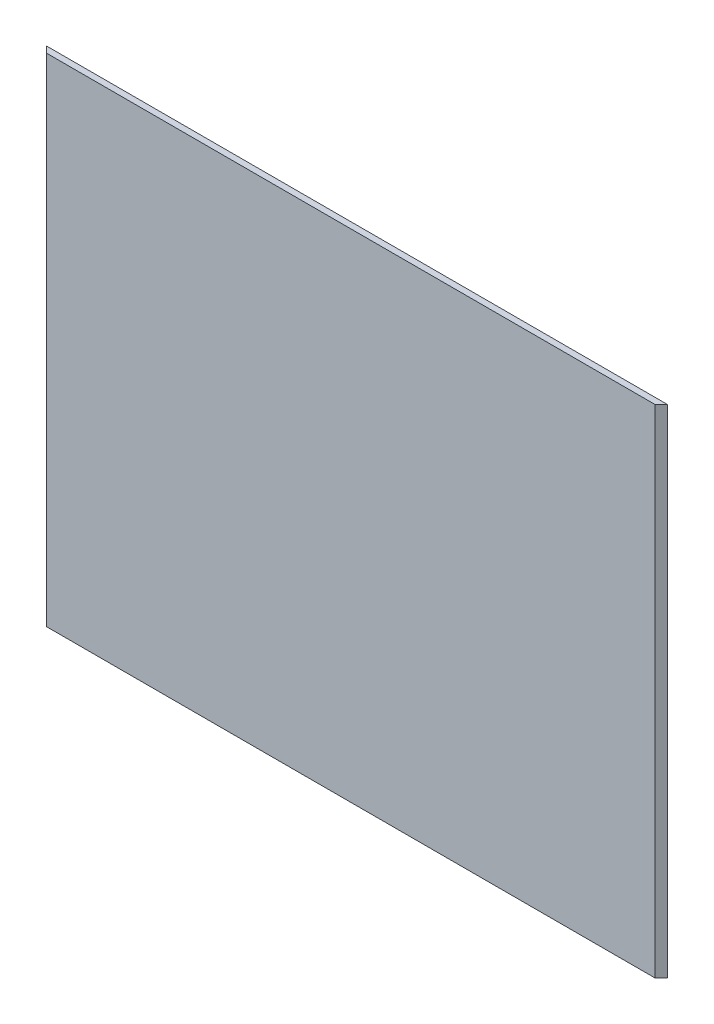
from build123d import *

# Parameters (mm, degrees)
ESQUISSE1_W             = 500
ESQUISSE1_H             = 400
BOSS_EXTRU_1_DEPTH      = 5
ENL_V_MAT_EXTRU_1_DEPTH = 472.725555805


with BuildPart() as part:
    # Esquisse1 → Boss.-Extru.1 (new body)
    with BuildSketch(Plane.XY):
        Rectangle(ESQUISSE1_W, ESQUISSE1_H)
    extrude(amount=BOSS_EXTRU_1_DEPTH)

    # Esquisse2 → Enlèv. mat.-Extru.1 (cut, through all)
    with BuildSketch(Plane(origin=(0, 200, 0), x_dir=(1, 0, 0), z_dir=(0, 1, 0))):
        Polygon((-250, -5), (-250, 0), (-245, -5), align=None)
        Polygon((245, -5), (250, -5), (250, 0), align=None)
    extrude(amount=-ENL_V_MAT_EXTRU_1_DEPTH, mode=Mode.SUBTRACT)


solid = part.part
